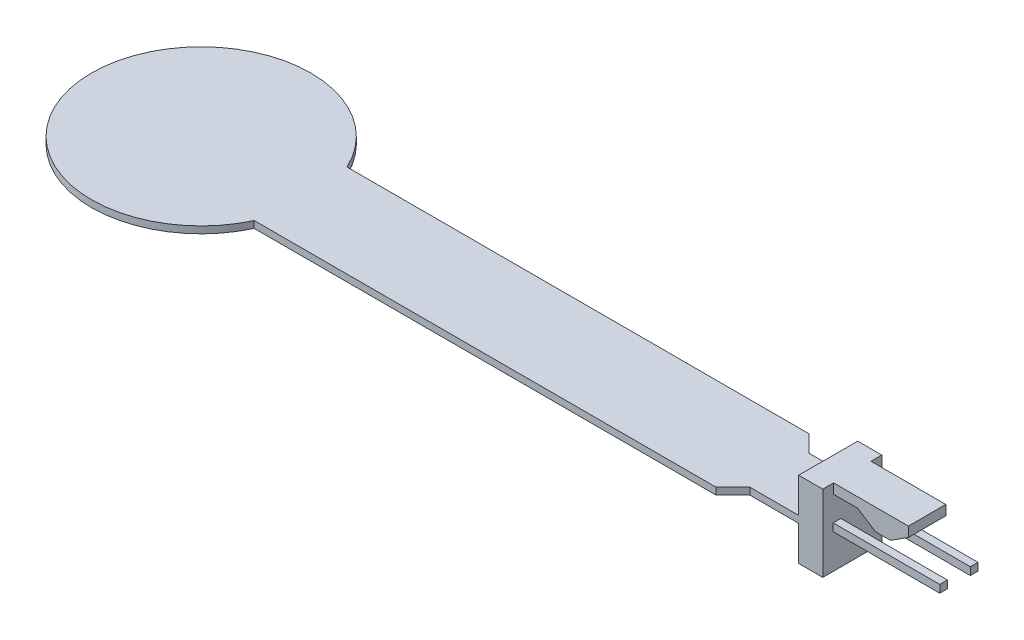
from build123d import *

# Parameters (mm, degrees)
BOSS_EXTRUDE1_DEPTH = 0.285
SKETCH2_W           = 4.9
SKETCH2_H           = 6.35
BOSS_EXTRUDE2_DEPTH = 2
BOSS_EXTRUDE3_DEPTH = 1.555
SKETCH4_W           = 0.635
SKETCH4_H           = 0.635
BOSS_EXTRUDE4_DEPTH = 8.85


with BuildPart() as part:
    # Sketch1 → Boss-Extrude1 (new, symmetric)
    with BuildSketch(Plane(origin=(0, 0, 0), x_dir=(1, 0, 0), z_dir=(0, 1, 0))):
        with BuildLine():
            Line((8.256488358, 3.85), (46.598758561, 3.85))
            Line((46.598758561, 3.85), (47.998758561, 2.45))
            Line((47.998758561, 2.45), (52.06, 2.45))
            Line((52.06, 2.45), (52.06, -2.45))
            Line((52.06, -2.45), (47.998758561, -2.45))
            Line((47.998758561, -2.45), (46.598758561, -3.85))
            Line((46.598758561, -3.85), (8.256488358, -3.85))
            ThreePointArc((8.256488358, -3.85), (-9.11, 0), (8.256488358, 3.85))
        make_face()
    extrude(amount=BOSS_EXTRUDE1_DEPTH, both=True)

    # Sketch2 → Boss-Extrude2 (add)
    with BuildSketch(Plane(origin=(52.06, 0, 0), x_dir=(0, 0, -1), z_dir=(1, 0, 0))):
        Rectangle(SKETCH2_W, SKETCH2_H)
    extrude(amount=BOSS_EXTRUDE2_DEPTH)

    # Sketch3 → Boss-Extrude3 (add, symmetric)
    with BuildSketch(Plane.XY):
        Polygon((54.06, 3.175), (60.27, 3.175), (60.27, 2.355), (58.79, 1.405), (57.54, 1.405), (56.06, 2.355), (54.06, 2.355), align=None)
    extrude(amount=BOSS_EXTRUDE3_DEPTH, both=True)

    # Sketch4 → Boss-Extrude4 (add)
    with BuildSketch(Plane(origin=(54.06, 0, 0), x_dir=(0, 0, -1), z_dir=(1, 0, 0))):
        with Locations((-1.27, 0)):
            Rectangle(SKETCH4_W, SKETCH4_H)
        with Locations((1.27, 0)):
            Rectangle(SKETCH4_W, SKETCH4_H)
    extrude(amount=BOSS_EXTRUDE4_DEPTH)


solid = part.part
